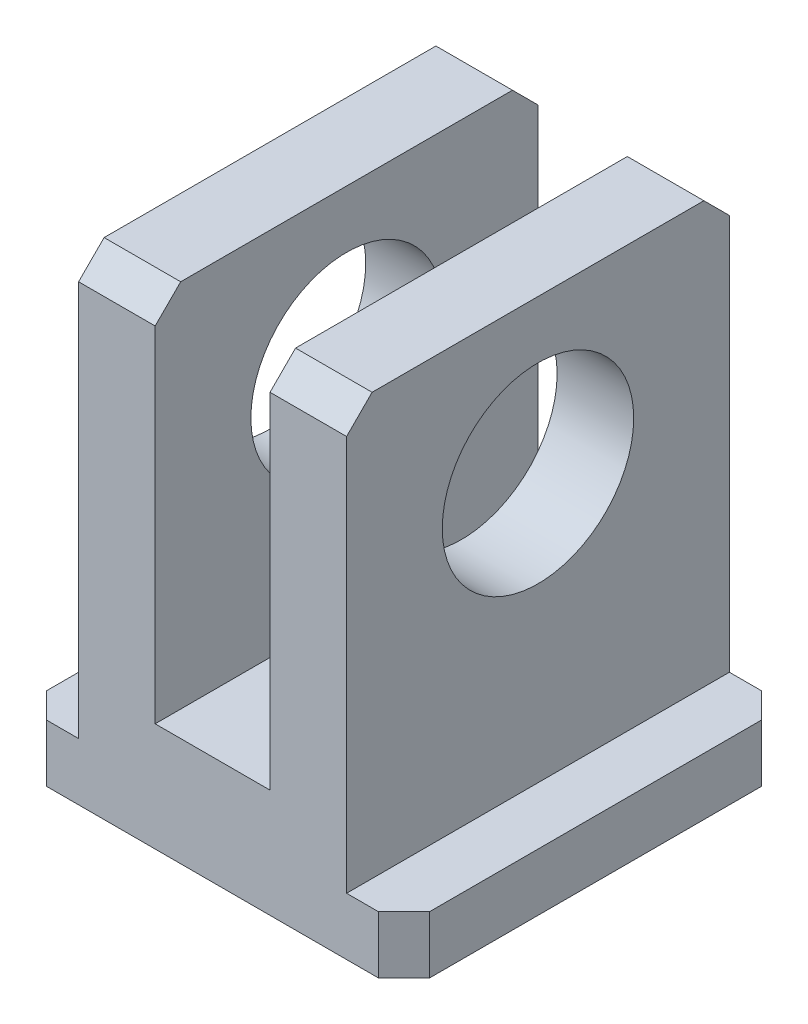
from build123d import *

# Parameters (mm, degrees)
EXTRUDE_1_DEPTH     = 37.5
CUT_EXTRUDE_1_DEPTH = 33
CUT_EXTRUDE_2_DEPTH = 33
CUT_EXTRUDE_3_DEPTH = 29
SKETCH_12_R         = 7.5
CUT_EXTRUDE_5_DEPTH = 48.765049984
CUT_EXTRUDE_6_DEPTH = 48.765049984
CUT_EXTRUDE_7_DEPTH = 48.765049984


with BuildPart() as part:
    # 草图1 → 凸台-拉伸1 (new body)
    with BuildSketch(Plane(origin=(0, 0, 0), x_dir=(1, 0, 0), z_dir=(0, 1, 0))):
        Polygon((-15, 13), (-13, 15), (13, 15), (15, 13), (15, -13), (13, -15), (-13, -15), (-15, -13), align=None)
    extrude(amount=EXTRUDE_1_DEPTH)

    # 草图2 → 切除-拉伸1 (cut)
    with BuildSketch(Plane(origin=(0, 37.5, 0), x_dir=(1, 0, 0), z_dir=(0, 1, 0))):
        Polygon((-10.5, 15), (-10.5, -15), (-13, -15), (-15, -13), (-15, 13), (-13, 15), align=None)
    extrude(amount=-CUT_EXTRUDE_1_DEPTH, mode=Mode.SUBTRACT)

    # 草图5 → 切除-拉伸2 (cut)
    with BuildSketch(Plane(origin=(0, 37.5, 0), x_dir=(1, 0, 0), z_dir=(0, 1, 0))):
        Polygon((10.5, 15), (10.5, -15), (13, -15), (15, -13), (15, 13), (13, 15), align=None)
    extrude(amount=-CUT_EXTRUDE_2_DEPTH, mode=Mode.SUBTRACT)

    # 草图6 → 切除-拉伸3 (cut)
    with BuildSketch(Plane(origin=(0, 37.5, 0), x_dir=(1, 0, 0), z_dir=(0, 1, 0))):
        Polygon((4.5, 15), (0, 15), (-4.5, 15), (-4.5, -15), (4.5, -15), align=None)
    extrude(amount=-CUT_EXTRUDE_3_DEPTH, mode=Mode.SUBTRACT)

    # 草图12 → 切除-拉伸5 (cut, through all)
    with BuildSketch(Plane(origin=(10.5, 0, 0), x_dir=(0, 0, -1), z_dir=(1, 0, 0))):
        with Locations((0, 25.5)):
            Circle(SKETCH_12_R)
    extrude(amount=-CUT_EXTRUDE_5_DEPTH, mode=Mode.SUBTRACT)

    # 草图14 → 切除-拉伸6 (cut, through all)
    with BuildSketch(Plane(origin=(10.5, 0, 0), x_dir=(0, 0, -1), z_dir=(1, 0, 0))):
        Polygon((-15, 37.5), (-13, 37.5), (-15, 35.5), align=None)
    extrude(amount=-CUT_EXTRUDE_6_DEPTH, mode=Mode.SUBTRACT)

    # 草图15 → 切除-拉伸7 (cut, through all)
    with BuildSketch(Plane(origin=(10.5, 0, 0), x_dir=(0, 0, -1), z_dir=(1, 0, 0))):
        Polygon((15, 37.5), (13, 37.5), (15, 35.5), align=None)
    extrude(amount=-CUT_EXTRUDE_7_DEPTH, mode=Mode.SUBTRACT)


solid = part.part
